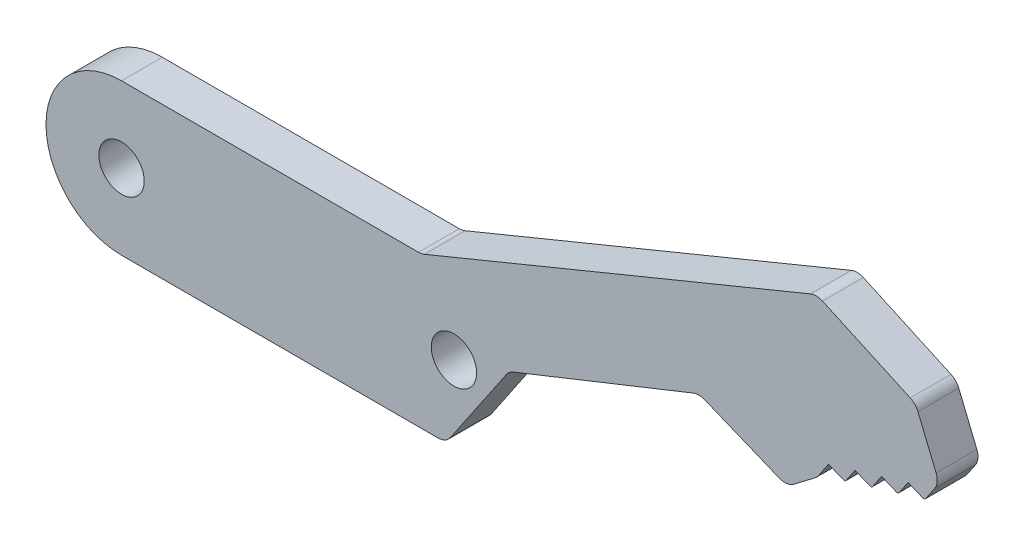
from build123d import *

# Parameters (mm, degrees)
SKETCH1_R           = 1.5
BOSS_EXTRUDE1_DEPTH = 2.7
FILLET1_R           = 0.15
FILLET2_R           = 1
FILLET3_R           = 1
FILLET4_R           = 1


with BuildPart() as part:
    # Sketch1 → Boss-Extrude1 (new body)
    with BuildSketch(Plane.XY):
        with BuildLine():
            Line((0, 5), (19.85, 5))
            Line((19.85, 5), (45.99619398, 15.75))
            Line((45.99619398, 15.75), (52.557536486, 12.761206845))
            Line((52.557536486, 12.761206845), (53.907471601, 9.477889135))
            ThreePointArc((53.907471601, 9.477889135), (53.977314115, 8.995006796), (53.810360044, 8.536553233))
            Line((53.810360044, 8.536553233), (53.148294507, 7.559788561))
            Line((53.148294507, 7.559788561), (52.056234711, 8.006784537))
            Line((52.056234711, 8.006784537), (51.394169174, 7.030019865))
            Line((51.394169174, 7.030019865), (50.302109378, 7.477015841))
            Line((50.302109378, 7.477015841), (49.640043841, 6.500251169))
            Line((49.640043841, 6.500251169), (48.547984045, 6.947247144))
            Line((48.547984045, 6.947247144), (47.885918508, 5.970482472))
            Line((47.885918508, 5.970482472), (46.793858712, 6.417478448))
            Line((46.793858712, 6.417478448), (46.131793175, 5.440713776))
            ThreePointArc((46.131793175, 5.440713776), (46.03170075, 5.315863389), (45.912975416, 5.208576821))
            Line((45.912975416, 5.208576821), (44.507662892, 4.129714813))
            ThreePointArc((44.507662892, 4.129714813), (44.031433487, 3.93177062), (43.519903831, 3.997449854))
            Line((43.519903831, 3.997449854), (38.212047423, 6.170032768))
            Line((38.212047423, 6.170032768), (25.644379319, 1.158584034))
            Line((25.644379319, 1.158584034), (21.47, -5))
            Line((21.47, -5), (0, -5))
            ThreePointArc((0, -5), (-5, 0), (0, 5))
        make_face()
        Circle(SKETCH1_R, mode=Mode.SUBTRACT)
        with Locations((22, 0)):
            Circle(SKETCH1_R, mode=Mode.SUBTRACT)
    extrude(amount=-BOSS_EXTRUDE1_DEPTH)

    # Fillet1
    fillet1_edges = [part.edges().sort_by_distance(p)[0] for p in [
        (53.148294507, 7.559788561, -1.35),
        (51.394169174, 7.030019865, -1.35),
        (49.640043841, 6.500251169, -1.35),
        (47.885918508, 5.970482472, -1.35),
    ]]
    fillet(fillet1_edges, radius=FILLET1_R)

    # Fillet2
    fillet2_edges = [part.edges().sort_by_distance(p)[0] for p in [
        (21.47, -5, -1.35),
        (45.99619398, 15.75, -1.35),
        (52.557536486, 12.761206845, -1.35),
    ]]
    fillet(fillet2_edges, radius=FILLET2_R)

    # Fillet3
    fillet3_edges = [part.edges().sort_by_distance(p)[0] for p in [
        (38.212047423, 6.170032768, -1.35),
        (25.644379319, 1.158584034, -1.35),
    ]]
    fillet(fillet3_edges, radius=FILLET3_R)

    # Fillet4
    fillet4_edges = [part.edges().sort_by_distance(p)[0] for p in [
        (19.85, 5, -1.35),
    ]]
    fillet(fillet4_edges, radius=FILLET4_R)


solid = part.part
